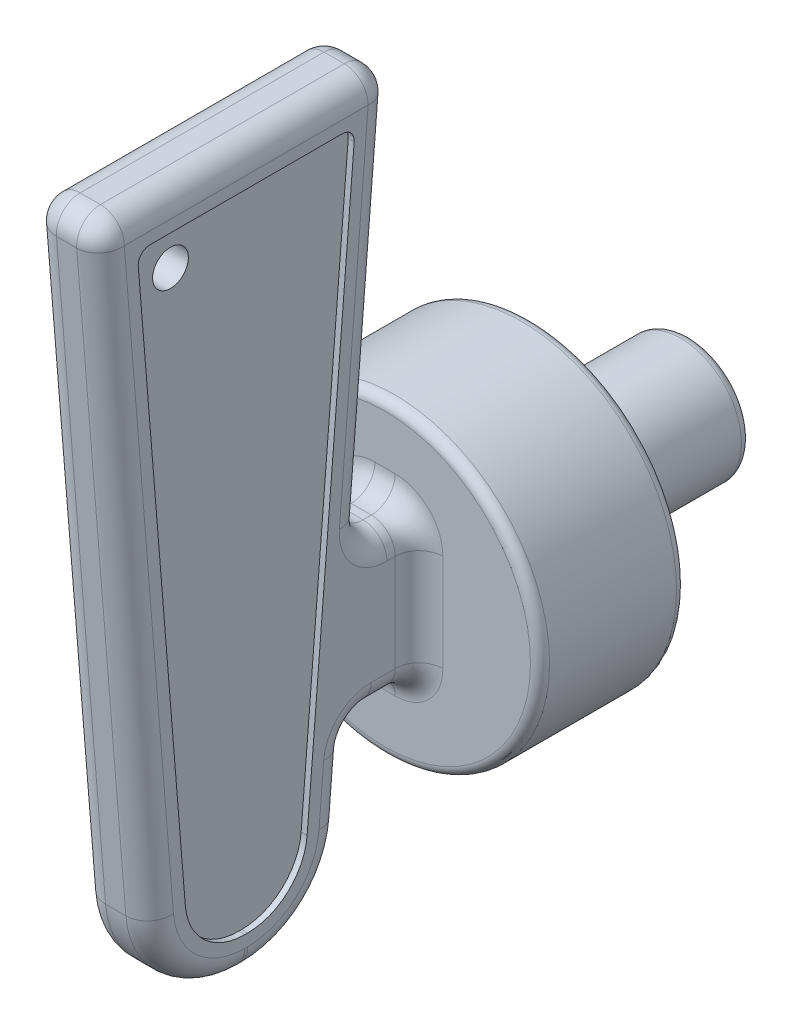
from build123d import *

# Parameters (mm, degrees)
SKETCH1_R                            = 13
BOSS_EXTRUDE1_DEPTH                  = 12.25
SHELL1_T                             = -2
SKETCH2_R                            = 5.1
BOSS_EXTRUDE2_DEPTH                  = 23.6
BOSS_EXTRUDE3_DEPTH                  = 2.85
SKETCH4_R                            = 2
BOSS_EXTRUDE4_DEPTH                  = 4
BOSS_EXTRUDE4_DIRECTION_2_REACH      = 63.121
BOSS_EXTRUDE4_DIRECTION_2_END_RADIUS = 5.1
FILLET1_R                            = 0.8
FILLET2_R                            = 0.8
FILLET3_R                            = 8
FILLET4_R                            = 2
FILLET5_R                            = 2
CUT_EXTRUDE1_DEPTH                   = 0.5
FILLET6_R                            = 1
FILLET6_OF_MIRROR1_R                 = 1
SKETCH6_R                            = 1.5
CUT_EXTRUDE2_DEPTH                   = 58.923108151


with BuildPart() as part:
    # Sketch1 → Boss-Extrude1 (new body)
    with BuildSketch(Plane.XY):
        Circle(SKETCH1_R)
    extrude(amount=BOSS_EXTRUDE1_DEPTH)

    # Shell1
    shell1_openings = [part.faces().sort_by_distance(p)[0] for p in [
        (0, 0, 0),
    ]]
    offset(amount=SHELL1_T, openings=shell1_openings, kind=Kind.INTERSECTION)

    # Sketch2 → Boss-Extrude2 (add)
    with BuildSketch(Plane(origin=(0, 0, 10.25), x_dir=(-1, 0, 0), z_dir=(0, 0, -1))):
        with Locations(Location((0, 0, 0), (0, 0, 180))):
            Circle(SKETCH2_R)
    extrude(amount=BOSS_EXTRUDE2_DEPTH)

    # Sketch3 → Boss-Extrude3 (add, symmetric)
    with BuildSketch(Plane(origin=(0, 0, 0), x_dir=(0, 0, -1), z_dir=(1, 0, 0))):
        Polygon((-12.25, -6.075), (-12.25, 6.075), (-17.11593178, 6.075), (-18.106530782, -6.075), align=None)
        Polygon((-18.106530782, -6.075), (-17.11593178, 6.075), (-14.35, 40), (-26.75, 40), (-26.75, -20.1), (-19.25, -20.1), align=None)
        Polygon((-26.75, -20.1), (-26.75, 40), (-39.15, 40), (-34.25, -20.1), align=None)
    extrude(amount=BOSS_EXTRUDE3_DEPTH, both=True)

    # Sketch4 → Boss-Extrude4 (add)
    with BuildSketch(Plane(origin=(0, -5.1, 0), x_dir=(-1, 0, 0), z_dir=(0, -1, 0))):
        with Locations(Location((0, 4.85, 0), (0, 0, 270))):
            Circle(SKETCH4_R)
    extrude(amount=BOSS_EXTRUDE4_DEPTH)

    # Boss-Extrude4 direction 2: up to this cylinder (the profile starts outside it)
    boss_extrude4_direction_2_end = Plane(origin=(0, 0, -4.85), z_dir=(0, 0, 1)) * Cylinder(BOSS_EXTRUDE4_DIRECTION_2_END_RADIUS, 137.442, mode=Mode.PRIVATE)
    # Sketch4 → Boss-Extrude4 direction 2 (add, up to the surface)
    with BuildSketch(Plane(origin=(0, -5.1, 0), x_dir=(-1, 0, 0), z_dir=(0, -1, 0)), mode=Mode.PRIVATE) as boss_extrude4_direction_2_sk1:
        with Locations(Location((0, 4.85, 0), (0, 0, 270))):
            Circle(SKETCH4_R)
    boss_extrude4_direction_2_tool1 = extrude(boss_extrude4_direction_2_sk1.sketch, amount=-BOSS_EXTRUDE4_DIRECTION_2_REACH, mode=Mode.PRIVATE) - boss_extrude4_direction_2_end
    add(boss_extrude4_direction_2_tool1.solids().sort_by_distance((0, -5.1, -4.85))[0])
    add(boss_extrude4_direction_2_tool1.solids().sort_by_distance((0, -5.1, -4.85))[1])

    # Fillet1
    fillet1_edges = [part.edges().sort_by_distance(p)[0] for p in [
        (0, -9.1, -6.85),
    ]]
    fillet(fillet1_edges, radius=FILLET1_R)

    # Fillet2
    fillet2_edges = [part.edges().sort_by_distance(p)[0] for p in [
        (-5.1, 0, -13.35),
        (-13, 0, 0),
        (-13, 0, 12.25),
    ]]
    fillet(fillet2_edges, radius=FILLET2_R)

    # Fillet3
    fillet3_edges = [part.edges().sort_by_distance(p)[0] for p in [
        (0, -20.1, 34.25),
        (0, -20.1, 19.25),
    ]]
    fillet(fillet3_edges, radius=FILLET3_R)

    # Fillet4
    fillet4_edges = [part.edges().sort_by_distance(p)[0] for p in [
        (0, 40, 14.35),
        (0, 40, 39.15),
    ]]
    fillet(fillet4_edges, radius=FILLET4_R)

    # Fillet5
    fillet5_edges = [part.edges().sort_by_distance(p)[0] for p in [
        (-2.85, 6.075, 14.68296589),
        (0, 6.075, 12.25),
        (-2.85, 21.956238853, 15.821121957),
        (0, 6.075, 17.11593178),
        (2.85, -6.075, 15.178265391),
        (0, -6.075, 18.106530782),
        (2.85, 0, 12.25),
        (0, -6.075, 12.25),
        (2.85, 6.075, 14.68296589),
        (2.85, 21.956238853, 15.821121957),
        (-2.85, 0, 12.25),
        (-2.85, -6.075, 15.178265391),
        (-2.85, -20.1, 26.75),
        (2.85, -20.1, 26.75),
        (-2.85, -9.412544588, 18.378643402),
        (-2.85, -17.982206789, 21.202154986),
        (-2.85, -17.982206789, 32.297845014),
        (2.85, -9.412544588, 18.378643402),
        (2.85, -17.982206789, 21.202154986),
        (2.85, -17.982206789, 32.297845014),
        (-2.85, 12.543694265, 36.911465922),
        (2.85, 12.543694265, 36.911465922),
        (-2.85, 40, 26.75),
        (-2.85, 39.355535948, 15.049146125),
        (-2.85, 39.355535948, 38.450853875),
        (2.85, 40, 26.75),
        (2.85, 39.355535948, 15.049146125),
        (2.85, 39.355535948, 38.450853875),
    ]]
    fillet(fillet5_edges, radius=FILLET5_R)

    # Sketch5 → Cut-Extrude1 (cut)
    with BuildSketch(Plane(origin=(2.85, 0, 0), x_dir=(0, 0, -1), z_dir=(1, 0, 0))):
        with BuildLine():
            Line((-35.895453266, 37), (-31.859165444, -12.506305735))
            ThreePointArc((-31.859165444, -12.506305735), (-30.264541092, -15.776379243), (-26.875701222, -17.1))
            Line((-26.875701222, -17.1), (-26.624298778, -17.1))
            ThreePointArc((-26.624298778, -17.1), (-23.235458908, -15.776379243), (-21.640834556, -12.506305735))
            Line((-21.640834556, -12.506305735), (-21.246420309, -7.668694265))
            Line((-21.246420309, -7.668694265), (-19.92969818, 8.481305735))
            Line((-19.92969818, 8.481305735), (-17.604546734, 37))
            Line((-17.604546734, 37), (-35.895453266, 37))
        make_face()
    cut_extrude1 = extrude(amount=-CUT_EXTRUDE1_DEPTH, mode=Mode.SUBTRACT)

    # Fillet6
    fillet6_edges = [part.edges().sort_by_distance(p)[0] for p in [
        (2.6, 37, 35.895453266),
        (2.6, 37, 17.604546734),
    ]]
    fillet(fillet6_edges, radius=FILLET6_R)

    # Mirror1: Cut-Extrude1 across plane
    add(cut_extrude1.mirror(Plane(origin=(0, 0, 0), x_dir=(0, 0, 1), z_dir=(1, 0, 0))), mode=Mode.SUBTRACT)

    # Fillet6 of Mirror1
    fillet6_of_mirror1_edges = [part.edges().sort_by_distance(p)[0] for p in [
        (-2.6, 37, 35.895453266),
        (-2.6, 37, 17.604546734),
    ]]
    fillet(fillet6_of_mirror1_edges, radius=FILLET6_OF_MIRROR1_R)

    # Sketch6 → Cut-Extrude2 (cut, through all)
    with BuildSketch(Plane(origin=(2.35, 0, 0), x_dir=(0, 0, -1), z_dir=(1, 0, 0))):
        with Locations((-32.604776809, 33.966696078)):
            Circle(SKETCH6_R)
    extrude(amount=-CUT_EXTRUDE2_DEPTH, mode=Mode.SUBTRACT)


solid = part.part
